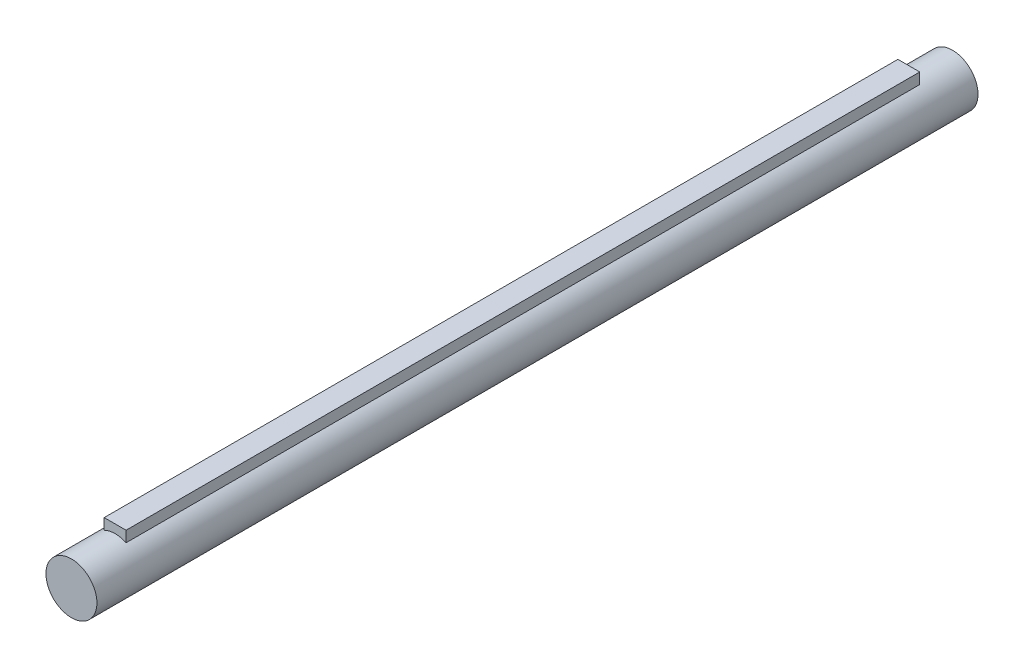
from build123d import *

# Parameters (mm, degrees)
BOSS_EXTRU_1_DEPTH      = 121
ENL_V_START             = -6
ENL_V_MAT_EXTRU_1_DEPTH = 6
ENL_V_MAT_EXTRU_2_DEPTH = 6


with BuildPart() as part:
    # Esquisse1 → Boss.-Extru.1 (new body)
    with BuildSketch(Plane.XY):
        with BuildLine():
            Line((-1.5, 3.16227766), (-1.5, 4.66227766))
            Line((-1.5, 4.66227766), (1.5, 4.66227766))
            Line((1.5, 4.66227766), (1.5, 3.16227766))
            ThreePointArc((1.5, 3.16227766), (0, -3.5), (-1.5, 3.16227766))
        make_face()
    extrude(amount=BOSS_EXTRU_1_DEPTH)

    # Esquisse2 → Enlèv. mat.-Extru.1 (cut)
    with BuildSketch(Plane.XY.offset(121).offset(ENL_V_START)):
        with BuildLine():
            ThreePointArc((-1.5, 3.16227766), (0, 3.5), (1.5, 3.16227766))
            Line((1.5, 3.16227766), (1.5, 4.66227766))
            Line((1.5, 4.66227766), (-1.5, 4.66227766))
            Line((-1.5, 4.66227766), (-1.5, 3.16227766))
        make_face()
    extrude(amount=ENL_V_MAT_EXTRU_1_DEPTH, mode=Mode.SUBTRACT)

    # Esquisse3 → Enlèv. mat.-Extru.2 (cut)
    with BuildSketch(Plane(origin=(0, 0, 0), x_dir=(-1, 0, 0), z_dir=(0, 0, -1))):
        with BuildLine():
            Line((-1.5, 4.66227766), (-1.5, 3.16227766))
            ThreePointArc((-1.5, 3.16227766), (0, 3.5), (1.5, 3.16227766))
            Line((1.5, 3.16227766), (1.5, 4.66227766))
            Line((1.5, 4.66227766), (-1.5, 4.66227766))
        make_face()
    extrude(amount=-ENL_V_MAT_EXTRU_2_DEPTH, mode=Mode.SUBTRACT)


solid = part.part
